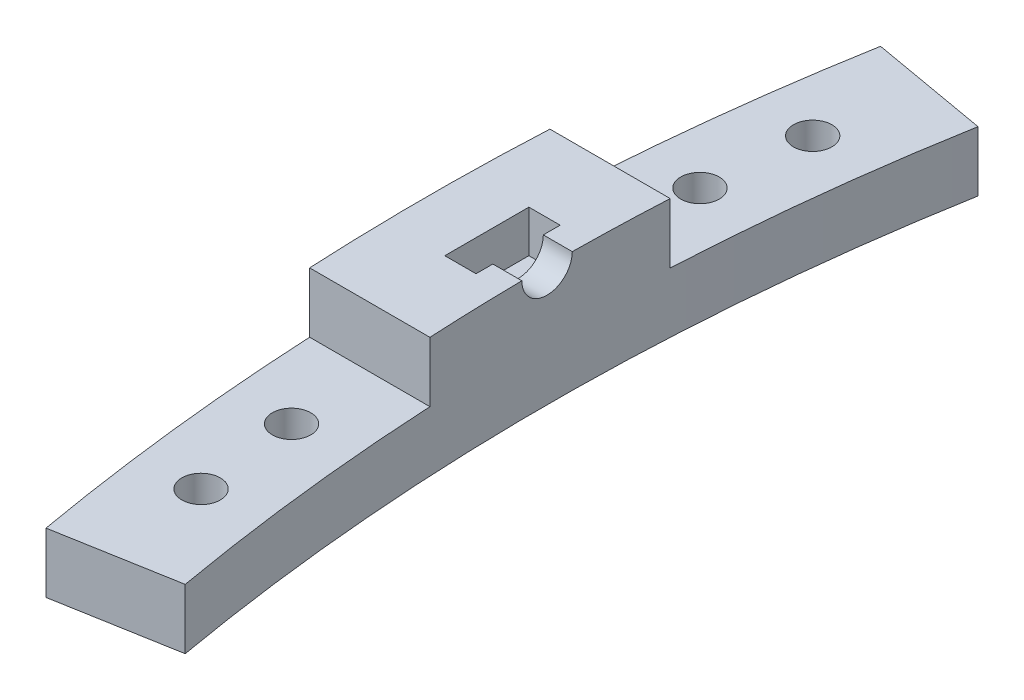
from build123d import *

# Parameters (mm, degrees)
BOSS_EXTRUDE1_DEPTH        = 5
BOSS_EXTRUDE2_DEPTH        = 5
SKETCH10_W                 = 7
SKETCH10_H                 = 7
CUT_EXTRUDE2_DEPTH         = 2.6
SKETCH11_R                 = 2.1
CUT_EXTRUDE3_DEPTH         = 37.99114612
F_3_2_3_2_DIAMETER_HOLE1_D = 3.2


with BuildPart() as part:
    # Sketch1 → Boss-Extrude1 (new body)
    with BuildSketch(Plane(origin=(0, 0, 0), x_dir=(1, 0, 0), z_dir=(0, 1, 0))):
        with BuildLine():
            Line((-196.961550602, 34.729635533), (-187.113473072, 32.993153757))
            ThreePointArc((-187.113473072, 32.993153757), (-190, 0), (-187.113473072, -32.993153757))
            Line((-187.113473072, -32.993153757), (-196.961550602, -34.729635533))
            ThreePointArc((-196.961550602, -34.729635533), (-200, 0), (-196.961550602, 34.729635533))
        make_face()
    extrude(amount=BOSS_EXTRUDE1_DEPTH)

    # Sketch9 → Boss-Extrude2 (add)
    with BuildSketch(Plane(origin=(0, 5, 0), x_dir=(1, 0, 0), z_dir=(0, 1, 0))):
        with BuildLine():
            Line((-199.749843554, 10), (-189.73665961, 10))
            ThreePointArc((-189.73665961, 10), (-190, 0), (-189.73665961, -10))
            Line((-189.73665961, -10), (-199.749843554, -10))
            ThreePointArc((-199.749843554, -10), (-200, 0), (-199.749843554, 10))
        make_face()
    extrude(amount=BOSS_EXTRUDE2_DEPTH)

    # Sketch10 → Cut-Extrude2 (cut)
    with BuildSketch(Plane.ZY.offset(195)):
        with Locations((0, 10)):
            Rectangle(SKETCH10_W, SKETCH10_H)
    extrude(amount=-CUT_EXTRUDE2_DEPTH, mode=Mode.SUBTRACT)

    # Sketch11 → Cut-Extrude3 (cut, through all)
    with BuildSketch(Plane.ZY.offset(195)):
        with Locations((0, 10)):
            Circle(SKETCH11_R)
    extrude(amount=-CUT_EXTRUDE3_DEPTH, mode=Mode.SUBTRACT)

    # Ø3.2 (3.2) Diameter Hole1 (through all)
    with Locations(Plane(origin=(0, 5, 0), x_dir=(1, 0, 0), z_dir=(0, 1, 0))):
        with Locations((-194.257966128, 16.995369836), (-193.331747968, 25.452607483), (-194.257966128, -16.995369836), (-193.331747968, -25.452607483)):
            Hole(F_3_2_3_2_DIAMETER_HOLE1_D / 2)


solid = part.part
